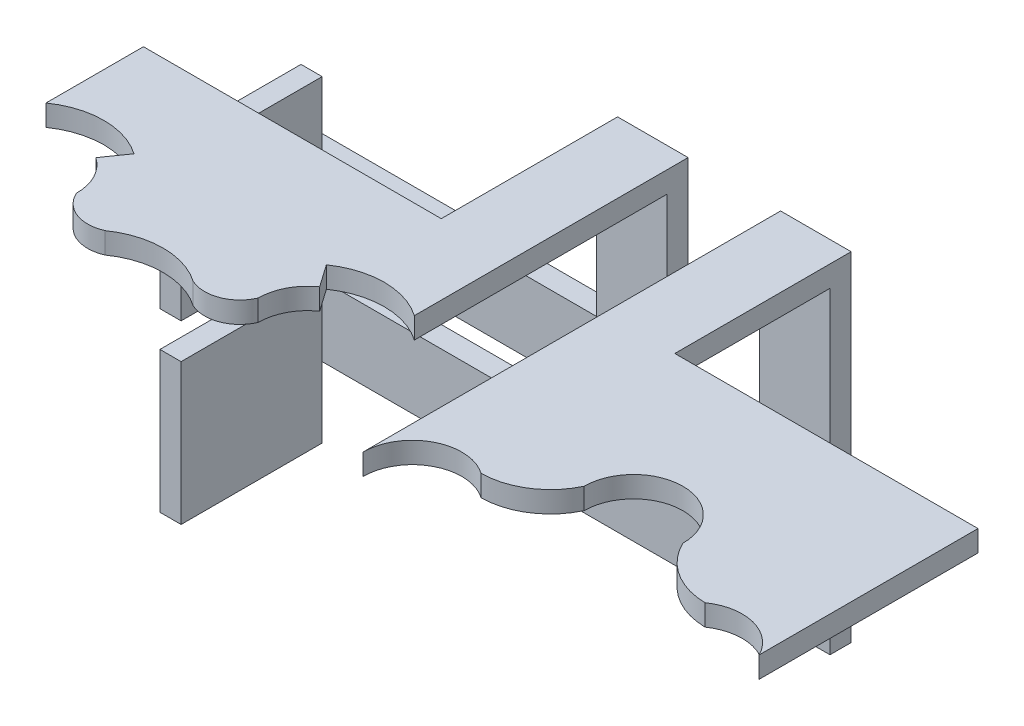
from build123d import *

# Parameters (mm, degrees)
BOSS_EXTRUDE1_DEPTH   = 3
BOSS_EXTRUDE1_2_DEPTH = 3
SKETCH3_W             = 10
SKETCH3_H             = 3
BOSS_EXTRUDE2_DEPTH   = 25
SKETCH4_W             = 10
SKETCH4_H             = 3
BOSS_EXTRUDE3_DEPTH   = 33
SKETCH5_W             = 10
SKETCH5_H             = 3
BOSS_EXTRUDE4_DEPTH   = 48
SKETCH6_W             = 3
SKETCH6_H             = 10
BOSS_EXTRUDE5_DEPTH   = 65
SKETCH7_W             = 3
SKETCH7_H             = 10
BOSS_EXTRUDE6_DEPTH   = 41.887643745
SKETCH8_W             = 3
SKETCH8_H             = 20
BOSS_EXTRUDE7_DEPTH   = 20


with BuildPart() as part:
    # Sketch1 → Boss-Extrude1 (new body)
    with BuildSketch(Plane(origin=(0, 0, 0), x_dir=(1, 0, 0), z_dir=(0, 1, 0))):
        with BuildLine():
            Line((-109.16363165, -1.669940304), (-106.941022959, 1.504273867))
            ThreePointArc((-106.941022959, 1.504273867), (-113.178666704, 3.470995386), (-119.41631045, 1.504273867))
            Line((-119.41631045, 1.504273867), (-119.41631045, 15.320995386))
            Line((-119.41631045, 15.320995386), (-67.190456925, 15.320995386))
            Line((-67.190456925, 15.320995386), (-67.190456925, 1.504273867))
            ThreePointArc((-67.190456925, 1.504273867), (-73.428100671, 3.470995386), (-79.665744416, 1.504273867))
            Line((-79.665744416, 1.504273867), (-77.443135725, -1.669940304))
            ThreePointArc((-77.443135725, -1.669940304), (-79.637176503, -4.171764322), (-80.428100671, -7.404004614))
            ThreePointArc((-80.428100671, -7.404004614), (-83.210469377, -10.07464784), (-87.065739942, -9.970726133))
            ThreePointArc((-87.065739942, -9.970726133), (-93.303383688, -8.004004614), (-99.541027433, -9.970726133))
            ThreePointArc((-99.541027433, -9.970726133), (-103.396297998, -10.07464784), (-106.178666704, -7.404004614))
            ThreePointArc((-106.178666704, -7.404004614), (-106.969590872, -4.171764322), (-109.16363165, -1.669940304))
        make_face()
    extrude(amount=BOSS_EXTRUDE1_DEPTH)



with BuildPart() as body_2:
    # Sketch1 → Boss-Extrude1 2 (new body)
    with BuildSketch(Plane(origin=(0, 0, 0), x_dir=(1, 0, 0), z_dir=(0, 1, 0))):
        with BuildLine():
            Line((-54.078100671, -18.879004614), (-54.078100671, 15.320995386))
            Line((-54.078100671, 15.320995386), (-1.089890892, 15.320995386))
            Line((-1.089890892, 15.320995386), (-1.089890892, -15.70224518))
            ThreePointArc((-1.089890892, -15.70224518), (-5.627623756, -12.088547855), (-11.332738428, -13.138068924))
            ThreePointArc((-11.332738428, -13.138068924), (-16.58656989, -11.537633756), (-20.202817654, -7.404004614))
            ThreePointArc((-20.202817654, -7.404004614), (-27.202817654, -0.404004614), (-34.202817654, -7.404004614))
            ThreePointArc((-34.202817654, -7.404004614), (-37.819065418, -11.537633756), (-43.07289688, -13.138068924))
            ThreePointArc((-43.07289688, -13.138068924), (-50.315659432, -12.672700298), (-54.078100671, -18.879004614))
        make_face()
    extrude(amount=BOSS_EXTRUDE1_2_DEPTH)


with BuildPart() as part_1:
    add(part.part)

    add(body_2.part)  # Boss-Extrude2 merges body 2
    # Sketch3 → Boss-Extrude2 (add)
    with BuildSketch(Plane(origin=(0, 0, -15.320995386), x_dir=(-1, 0, 0), z_dir=(0, 0, -1))):
        with Locations((72.190456925, 1.5)):
            Rectangle(SKETCH3_W, SKETCH3_H)
        with Locations((49.078100671, 1.5)):
            Rectangle(SKETCH3_W, SKETCH3_H)
    extrude(amount=BOSS_EXTRUDE2_DEPTH)

    # Sketch4 → Boss-Extrude3 (add)
    with BuildSketch(Plane(origin=(0, 3, 0), x_dir=(1, 0, 0), z_dir=(0, 1, 0))):
        with Locations((-72.190456925, 38.820995386)):
            Rectangle(SKETCH4_W, SKETCH4_H)
    extrude(amount=-BOSS_EXTRUDE3_DEPTH)

    # Sketch5 → Boss-Extrude4 (add)
    with BuildSketch(Plane(origin=(0, 3, 0), x_dir=(1, 0, 0), z_dir=(0, 1, 0))):
        with Locations((-49.078100671, 38.820995386)):
            Rectangle(SKETCH5_W, SKETCH5_H)
    extrude(amount=-BOSS_EXTRUDE4_DEPTH)

    # Sketch6 → Boss-Extrude5 (add)
    with BuildSketch(Plane.ZY.offset(54.078100671)):
        with Locations((-38.820995386, -40)):
            Rectangle(SKETCH6_W, SKETCH6_H)
    extrude(amount=BOSS_EXTRUDE5_DEPTH)

    # Sketch7 → Boss-Extrude6 (add)
    with BuildSketch(Plane.ZY.offset(77.190456925)):
        with Locations((-38.820995386, -25)):
            Rectangle(SKETCH7_W, SKETCH7_H)
    extrude(amount=BOSS_EXTRUDE6_DEPTH)

    # Sketch8 → Boss-Extrude7 (add)
    with BuildSketch(Plane.XY.offset(-37.320995386)):
        with Locations((-117.578100671, -20)):
            Rectangle(SKETCH8_W, SKETCH8_H)
        with Locations((-117.578100671, -45)):
            Rectangle(SKETCH8_W, SKETCH8_H)
    extrude(amount=BOSS_EXTRUDE7_DEPTH)


solid = part_1.part
